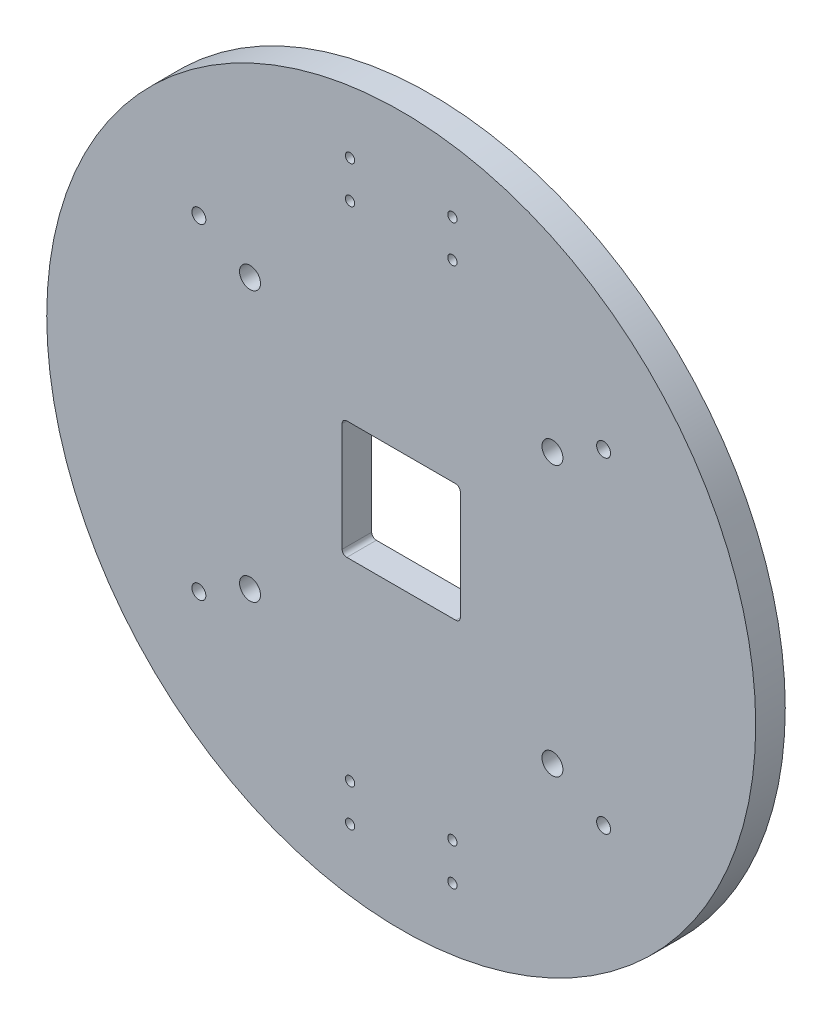
from build123d import *

# Parameters (mm, degrees)
SKETCH1_R           = 76.2
SKETCH1_R_2         = 2.25
SKETCH1_R_3         = 1.5
SKETCH1_R_4         = 1
SKETCH1_W           = 25.4
SKETCH1_H           = 25.4
BOSS_EXTRUDE2_DEPTH = 6.35
FILLET3_R           = 1
FILLET4_R           = 1
FILLET5_R           = 1
FILLET6_R           = 1


with BuildPart() as part:
    # Sketch1 → Boss-Extrude2 (new body)
    with BuildSketch(Plane.XY):
        Circle(SKETCH1_R)
        with Locations((-32.5, 29)):
            Circle(SKETCH1_R_2, mode=Mode.SUBTRACT)
        with Locations((-32.5, -29)):
            Circle(SKETCH1_R_2, mode=Mode.SUBTRACT)
        with Locations((32.5, -29)):
            Circle(SKETCH1_R_2, mode=Mode.SUBTRACT)
        with Locations((32.5, 29)):
            Circle(SKETCH1_R_2, mode=Mode.SUBTRACT)
        with Locations((43.5, 35)):
            Circle(SKETCH1_R_3, mode=Mode.SUBTRACT)
        with Locations((-43.5, 35)):
            Circle(SKETCH1_R_3, mode=Mode.SUBTRACT)
        with Locations((43.5, -35)):
            Circle(SKETCH1_R_3, mode=Mode.SUBTRACT)
        with Locations((-43.5, -35)):
            Circle(SKETCH1_R_3, mode=Mode.SUBTRACT)
        with Locations((-11, 54)):
            Circle(SKETCH1_R_4, mode=Mode.SUBTRACT)
        with Locations((11, 54)):
            Circle(SKETCH1_R_4, mode=Mode.SUBTRACT)
        with Locations((11, 62)):
            Circle(SKETCH1_R_4, mode=Mode.SUBTRACT)
        with Locations((-11, 62)):
            Circle(SKETCH1_R_4, mode=Mode.SUBTRACT)
        with Locations((-11, -62)):
            Circle(SKETCH1_R_4, mode=Mode.SUBTRACT)
        with Locations((-11, -54)):
            Circle(SKETCH1_R_4, mode=Mode.SUBTRACT)
        with Locations((11, -62)):
            Circle(SKETCH1_R_4, mode=Mode.SUBTRACT)
        with Locations((11, -54)):
            Circle(SKETCH1_R_4, mode=Mode.SUBTRACT)
        Rectangle(SKETCH1_W, SKETCH1_H, mode=Mode.SUBTRACT)
    extrude(amount=BOSS_EXTRUDE2_DEPTH)

    # Fillet3
    fillet3_edges = [part.edges().sort_by_distance(p)[0] for p in [
        (-12.7, -12.7, 3.175),
    ]]
    fillet(fillet3_edges, radius=FILLET3_R)

    # Fillet4
    fillet4_edges = [part.edges().sort_by_distance(p)[0] for p in [
        (12.7, 12.7, 3.175),
    ]]
    fillet(fillet4_edges, radius=FILLET4_R)

    # Fillet5
    fillet5_edges = [part.edges().sort_by_distance(p)[0] for p in [
        (-12.7, 12.7, 3.175),
    ]]
    fillet(fillet5_edges, radius=FILLET5_R)

    # Fillet6
    fillet6_edges = [part.edges().sort_by_distance(p)[0] for p in [
        (12.7, -12.7, 3.175),
    ]]
    fillet(fillet6_edges, radius=FILLET6_R)


solid = part.part
